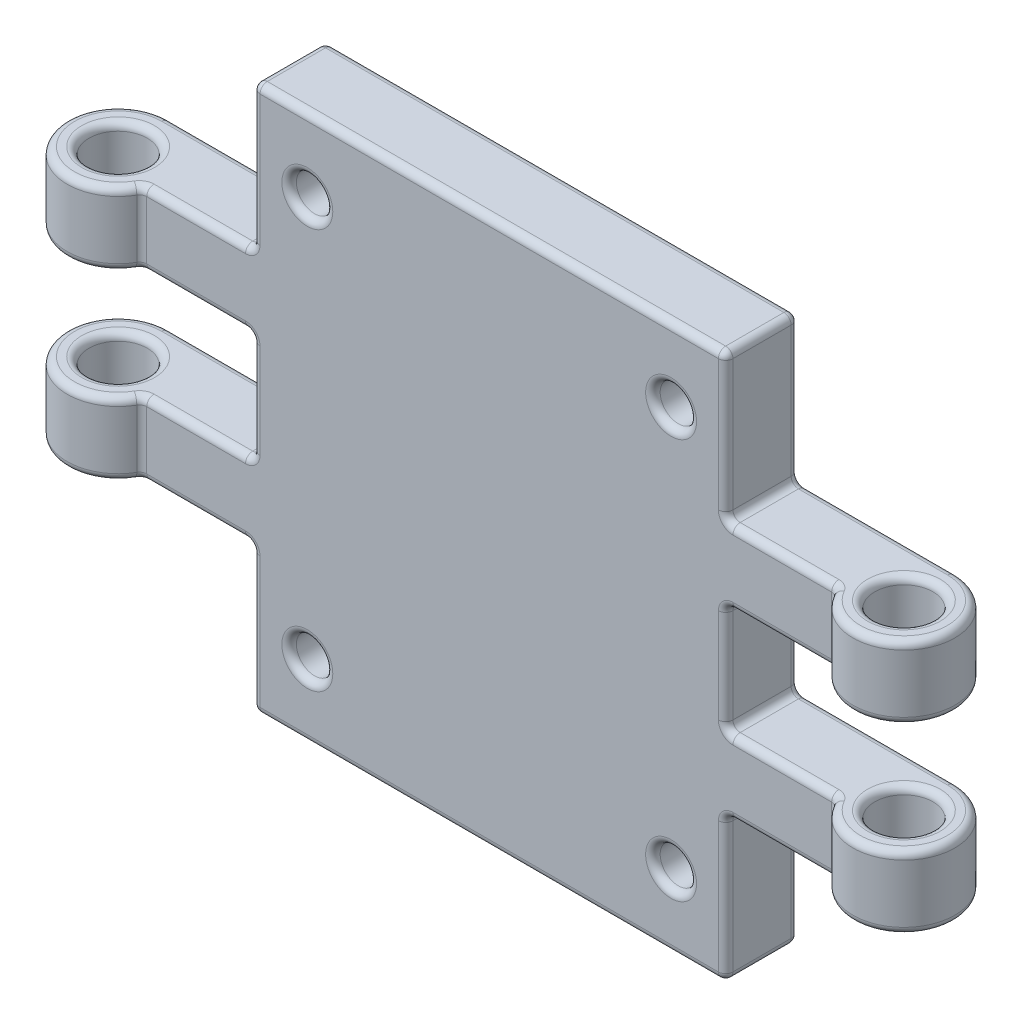
from build123d import *
from build123d.topology import SkipClean

# Parameters (mm, degrees)
BOSS_EXTRUDE1_DEPTH      = 10
BOSS_EXTRUDE2_DEPTH      = 17.5
BOSS_EXTRUDE2_DEPTH_BACK = 17.5
SKETCH2_R                = 7
SKETCH2_R_2              = 4
CUT_EXTRUDE2_DEPTH       = 35
CUT_EXTRUDE2_DEPTH_BACK  = 35
SKETCH3_R                = 2.5
SKETCH3_W                = 28.5
SKETCH3_H                = 15
CUT_EXTRUDE3_DEPTH       = 84.318665376
CUT_EXTRUDE4_DEPTH       = 84.318665376
FILLET1_R                = 1


with BuildPart() as part:
    # Sketch1 → Boss-Extrude1 (new body)
    with BuildSketch(Plane.XY):
        Polygon((-60.5, 7.5), (-32.5, 7.5), (-32.5, -7.5), (-60.5, -7.5), (-60.5, -17.5), (-32.5, -17.5), (-32.5, -37.5), (32.5, -37.5), (32.5, -17.5), (60.5, -17.5), (60.5, -7.5), (32.5, -7.5), (32.5, 7.5), (60.5, 7.5), (60.5, 17.5), (32.5, 17.5), (32.5, 37.5), (-32.5, 37.5), (-32.5, 17.5), (-60.5, 17.5), align=None)
    extrude(amount=BOSS_EXTRUDE1_DEPTH)

    # Sketch2 → Boss-Extrude2 (add, two sides: drawn at the far end of the back side and taken through both)
    # profile 1 of 2: a face of its own
    with BuildSketch(Plane.XZ.offset(-BOSS_EXTRUDE2_DEPTH_BACK)):
        with Locations((-54, 7)):
            Circle(SKETCH2_R)
        with Locations((-54, 7)):
            Circle(SKETCH2_R_2, mode=Mode.SUBTRACT)
    # profile 2 of 2: a face of its own
    with BuildSketch(Plane.XZ.offset(-BOSS_EXTRUDE2_DEPTH_BACK)):
        with Locations((54, 7)):
            Circle(SKETCH2_R)
        with Locations((54, 7)):
            Circle(SKETCH2_R_2, mode=Mode.SUBTRACT)
    extrude(amount=BOSS_EXTRUDE2_DEPTH + BOSS_EXTRUDE2_DEPTH_BACK)

    # Sketch3 → Cut-Extrude2 (cut, two sides: drawn at the far end of the back side and taken through both)
    with BuildSketch(Plane.XY.offset(10).offset(-CUT_EXTRUDE2_DEPTH_BACK)):
        with Locations((-25, -27.5)):
            Circle(SKETCH3_R)
        with Locations((-25, 27.5)):
            Circle(SKETCH3_R)
        with Locations((25, 27.5)):
            Circle(SKETCH3_R)
        with Locations((25, -27.5)):
            Circle(SKETCH3_R)
        with Locations((-46.75, 0)):
            Rectangle(SKETCH3_W, SKETCH3_H)
        with Locations((46.75, 0)):
            Rectangle(SKETCH3_W, SKETCH3_H)
    extrude(amount=CUT_EXTRUDE2_DEPTH + CUT_EXTRUDE2_DEPTH_BACK, mode=Mode.SUBTRACT)

    # Sketch4 → Cut-Extrude3 (cut, through all)
    with SkipClean():  # the faces are left unmerged after this step: merging them gives an invalid solid
        with BuildSketch(Plane.XZ.offset(17.5)):
            with BuildLine():
                ThreePointArc((-60.5, 9.598076211), (-60.415425978, 9.800412385), (-60.32455532, 10))
                Line((-60.32455532, 10), (-60.5, 10))
                Line((-60.5, 10), (-60.5, 9.598076211))
            make_face()
            with BuildLine():
                Line((-60.5, 0), (-54, 0))
                ThreePointArc((-54, 0), (-57.925141177, 1.20403013), (-60.5, 4.401923789))
                Line((-60.5, 4.401923789), (-60.5, 0))
            make_face()
            with BuildLine():
                ThreePointArc((-56.645751311, 10), (-54, 3), (-51.354248689, 10))
                Line((-51.354248689, 10), (-56.645751311, 10))
            make_face()
        extrude(amount=-CUT_EXTRUDE3_DEPTH, mode=Mode.SUBTRACT)

    # Sketch5 → Cut-Extrude4 (cut, through all)
    with SkipClean():  # the faces are left unmerged after this step: merging them gives an invalid solid
        with BuildSketch(Plane.XZ.offset(17.5)):
            with BuildLine():
                ThreePointArc((51.354248689, 10), (54, 3), (56.645751311, 10))
                Line((56.645751311, 10), (51.354248689, 10))
            make_face()
            with BuildLine():
                ThreePointArc((60.32455532, 10), (60.415425978, 9.800412385), (60.5, 9.598076211))
                Line((60.5, 9.598076211), (60.5, 10))
                Line((60.5, 10), (60.32455532, 10))
            make_face()
            with BuildLine():
                Line((60.5, 0), (60.5, 4.401923789))
                ThreePointArc((60.5, 4.401923789), (57.925141177, 1.20403013), (54, 0))
                Line((54, 0), (60.5, 0))
            make_face()
        extrude(amount=-CUT_EXTRUDE4_DEPTH, mode=Mode.SUBTRACT)

    # Fillet1
    fillet1_edges = [part.edges().sort_by_distance(p)[0] for p in [
        (43.25, 17.5, 0),
        (32.5, 27.5, 0),
        (0, 37.5, 0),
        (-43.25, 17.5, 0),
        (-43.25, -7.5, 0),
        (32.5, -27.5, 0),
        (43.25, -7.5, 0),
        (32.5, 0, 0),
        (32.5, -7.5, 5),
        (32.5, 37.5, 5),
        (32.5, 17.5, 5),
        (54, -7.5, 14),
        (54, 7.5, 14),
        (-54, -7.5, 14),
        (-54, 7.5, 14),
        (-27.5, -27.5, 0),
        (-27.5, -27.5, 10),
        (-27.5, 27.5, 0),
        (-27.5, 27.5, 10),
        (22.5, 27.5, 0),
        (22.5, 27.5, 10),
        (22.5, -27.5, 0),
        (22.5, -27.5, 10),
        (54, -17.5, 14),
        (54, -17.5, 3),
        (54, 17.5, 14),
        (54, 17.5, 3),
        (47.67544468, 12.5, 10),
        (47.67544468, -12.5, 10),
        (-54, 17.5, 3),
        (-54, 17.5, 14),
        (-54, -17.5, 3),
        (-54, -17.5, 14),
        (-47.67544468, -12.5, 10),
        (-47.67544468, 12.5, 10),
        (-32.5, 27.5, 0),
        (-43.25, 7.5, 0),
        (-32.5, 0, 0),
        (-43.25, -17.5, 0),
        (-32.5, -27.5, 0),
        (0, -37.5, 0),
        (43.25, -17.5, 0),
        (43.25, 7.5, 0),
        (40.08772234, 17.5, 10),
        (32.5, 27.5, 10),
        (0, 37.5, 10),
        (-32.5, 27.5, 10),
        (-40.08772234, 17.5, 10),
        (-40.08772234, 7.5, 10),
        (-32.5, 0, 10),
        (-40.08772234, -7.5, 10),
        (-40.08772234, -17.5, 10),
        (-32.5, -27.5, 10),
        (0, -37.5, 10),
        (32.5, -27.5, 10),
        (40.08772234, -17.5, 10),
        (40.08772234, -7.5, 10),
        (32.5, 0, 10),
        (40.08772234, 7.5, 10),
        (32.5, 7.5, 5),
        (32.5, -17.5, 5),
        (32.5, -37.5, 5),
        (-32.5, -37.5, 5),
        (-32.5, -17.5, 5),
        (-32.5, -7.5, 5),
        (-32.5, 7.5, 5),
        (-32.5, 17.5, 5),
        (-32.5, 37.5, 5),
        (54, -7.5, 3),
        (54, 7.5, 3),
        (-54, -7.5, 11),
        (-54, 7.5, 3),
    ]]
    fillet(fillet1_edges, radius=FILLET1_R)


solid = part.part
